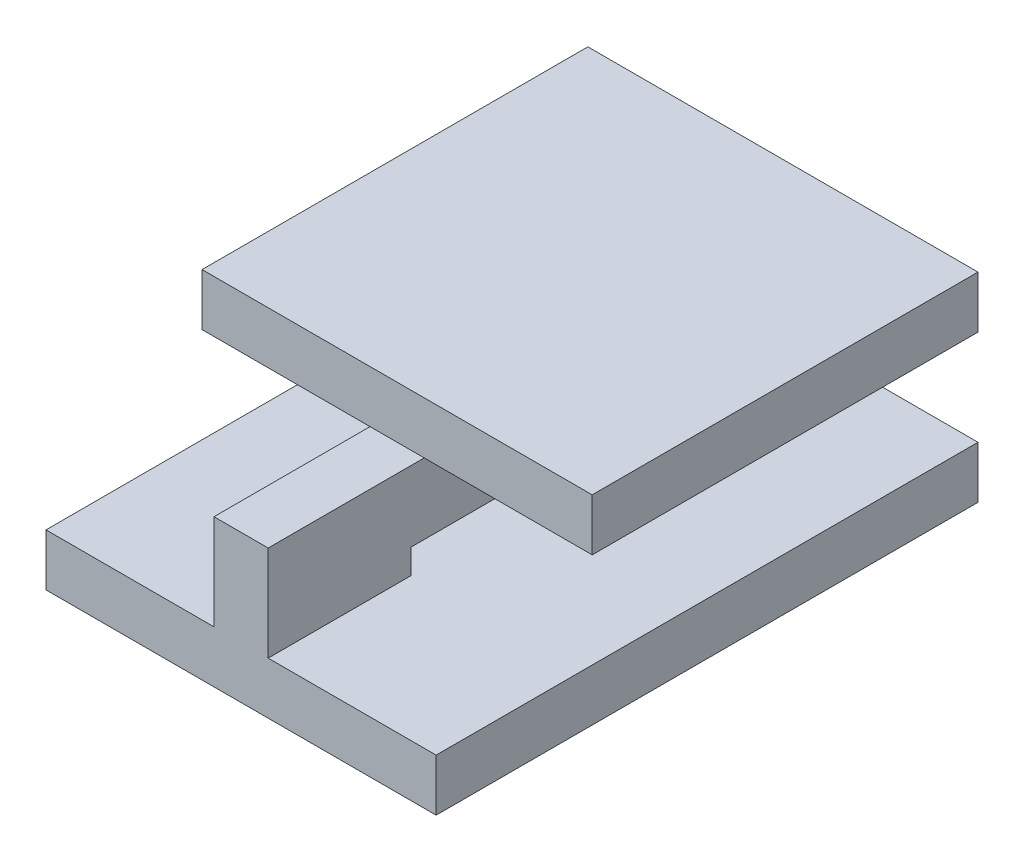
from build123d import *

# Parameters (mm, degrees)
SKETCH1_W           = 90
SKETCH1_H           = 125
BOSS_EXTRUDE1_DEPTH = 12
SKETCH2_W           = 12.5
SKETCH2_H           = 125
BOSS_EXTRUDE2_DEPTH = 22
SKETCH3_W           = 38.75
SKETCH3_H           = 89
SKETCH3_W_2         = 6.25
BOSS_EXTRUDE3_DEPTH = 12
SKETCH4_W           = 92.043364018
SKETCH4_H           = 5.697421696
CUT_EXTRUDE1_DEPTH  = 143.714969432


with BuildPart() as part:
    # Sketch1 → Boss-Extrude1 (new body)
    with BuildSketch(Plane(origin=(0, 0, 0), x_dir=(1, 0, 0), z_dir=(0, 1, 0))):
        with Locations((45, 62.5)):
            Rectangle(SKETCH1_W, SKETCH1_H)
    extrude(amount=BOSS_EXTRUDE1_DEPTH)

    # Sketch2 → Boss-Extrude2 (add)
    with BuildSketch(Plane(origin=(0, 12, 0), x_dir=(1, 0, 0), z_dir=(0, 1, 0))):
        with Locations((45, 62.5)):
            Rectangle(SKETCH2_W, SKETCH2_H)
    extrude(amount=BOSS_EXTRUDE2_DEPTH)

    # Sketch3 → Boss-Extrude3 (add)
    with BuildSketch(Plane(origin=(0, 34, 0), x_dir=(1, 0, 0), z_dir=(0, 1, 0))):
        with Locations((70.625, 80.5)):
            Rectangle(SKETCH3_W, SKETCH3_H)
        with Locations((19.375, 80.5)):
            Rectangle(SKETCH3_W, SKETCH3_H)
        with Locations((41.875, 80.5)):
            Rectangle(SKETCH3_W_2, SKETCH3_H)
        with Locations((48.125, 80.5)):
            Rectangle(SKETCH3_W_2, SKETCH3_H)
    extrude(amount=BOSS_EXTRUDE3_DEPTH)

    # Sketch4 → Cut-Extrude1 (cut, through all)
    with BuildSketch(Plane(origin=(51.25, 0, 0), x_dir=(0, 0, -1), z_dir=(1, 0, 0))):
        with Locations((78.978317991, 14.848710848)):
            Rectangle(SKETCH4_W, SKETCH4_H)
    extrude(amount=-CUT_EXTRUDE1_DEPTH, mode=Mode.SUBTRACT)


solid = part.part
